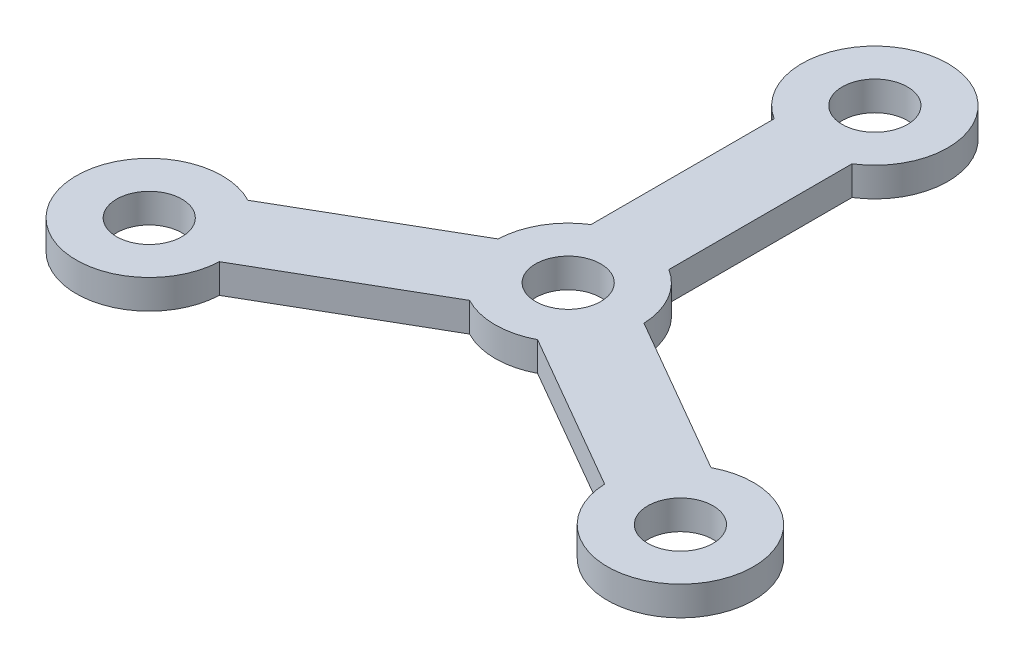
from build123d import *

# Parameters (mm, degrees)
SKETCH1_R           = 3.35
BOSS_EXTRUDE1_DEPTH = 3


with BuildPart() as part:
    # Sketch1 → Boss-Extrude1 (new body)
    with BuildSketch(Plane(origin=(0, 0, 0), x_dir=(1, 0, 0), z_dir=(0, 1, 0))):
        with BuildLine():
            ThreePointArc((4, 25.15571123), (0, 39), (-4, 25.15571123))
            Line((-4, 25.15571123), (-4, 6.34428877))
            ThreePointArc((-4, 6.34428877), (-6.495190528, 3.75), (-7.494315244, 0.29195723))
            Line((-7.494315244, 0.29195723), (-23.785484975, -9.113754))
            ThreePointArc((-23.785484975, -9.113754), (-33.774990748, -19.5), (-19.785484975, -16.04195723))
            Line((-19.785484975, -16.04195723), (-3.494315244, -6.636246))
            ThreePointArc((-3.494315244, -6.636246), (0, -7.5), (3.494315244, -6.636246))
            Line((3.494315244, -6.636246), (19.785484975, -16.04195723))
            ThreePointArc((19.785484975, -16.04195723), (33.774990748, -19.5), (23.785484975, -9.113754))
            Line((23.785484975, -9.113754), (7.494315244, 0.29195723))
            ThreePointArc((7.494315244, 0.29195723), (6.495190528, 3.75), (4, 6.34428877))
            Line((4, 6.34428877), (4, 25.15571123))
        make_face()
        with Locations((0, 31.5)):
            Circle(SKETCH1_R, mode=Mode.SUBTRACT)
        Circle(SKETCH1_R, mode=Mode.SUBTRACT)
        with Locations((27.279800219, -15.75)):
            Circle(SKETCH1_R, mode=Mode.SUBTRACT)
        with Locations((-27.279800219, -15.75)):
            Circle(SKETCH1_R, mode=Mode.SUBTRACT)
    extrude(amount=BOSS_EXTRUDE1_DEPTH)


solid = part.part
